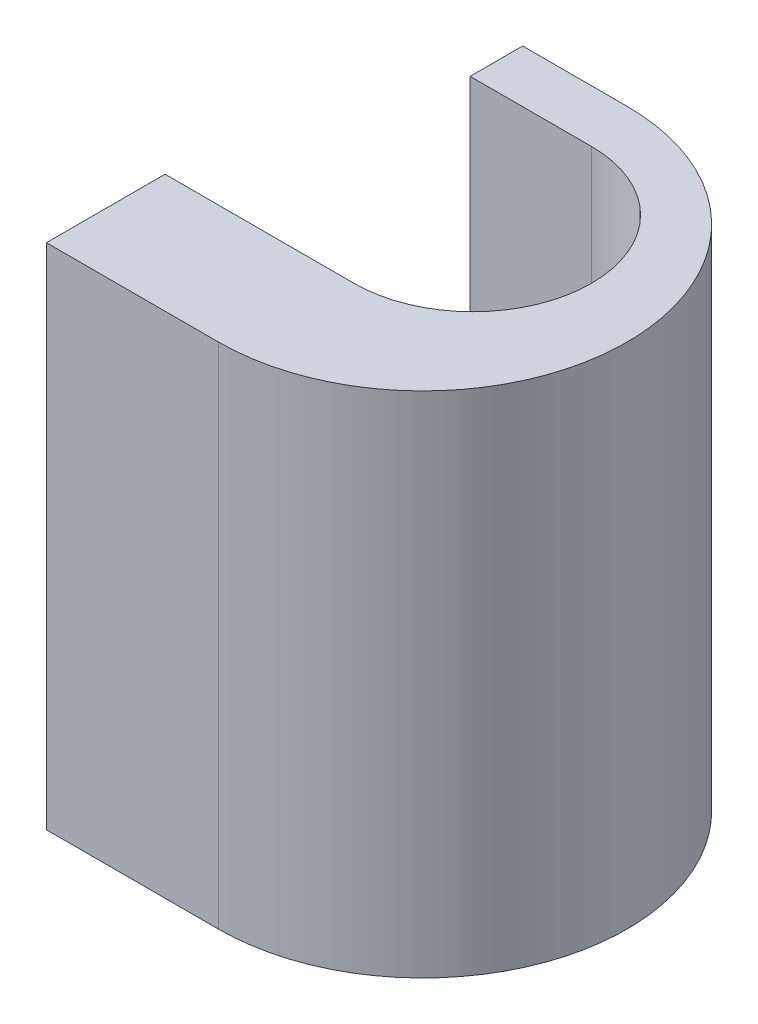
from build123d import *

# Parameters (mm, degrees)
SKETCH1_R           = 1.7
BOSS_EXTRUDE2_DEPTH = 4
BOSS_EXTRUDE3_DEPTH = 15


with BuildPart() as part:
    # Sketch1 → Boss-Extrude2 (new body)
    with BuildSketch(Plane(origin=(0, 0, 0), x_dir=(1, 0, 0), z_dir=(0, 1, 0))):
        with BuildLine():
            Line((-2.93579488, -0.53336368), (-2.93579488, 2.96663632))
            Line((-2.93579488, 2.96663632), (0.643666224, 2.96663632))
            ThreePointArc((0.643666224, 2.96663632), (4.143666224, -0.53336368), (0.643666224, -4.03336368))
            Line((0.643666224, -4.03336368), (-2.93579488, -4.03336368))
            Line((-2.93579488, -4.03336368), (-2.93579488, -0.53336368))
        make_face()
        with Locations(Location((0, 0, 0), (0, 0, 270))):
            Circle(SKETCH1_R, mode=Mode.SUBTRACT)
    extrude(amount=BOSS_EXTRUDE2_DEPTH)

    # Sketch2 → Boss-Extrude3 (add)
    with BuildSketch(Plane(origin=(0, 0, 0), x_dir=(1, 0, 0), z_dir=(0, 1, 0))):
        with BuildLine():
            Line((-2.93579488, 4.517571778), (0.143666226, 4.517571778))
            ThreePointArc((0.143666226, 4.517571778), (6.169133955, -1.507895951), (0.143666226, -7.53336368))
            Line((0.143666226, -7.53336368), (-3.435794878, -7.53336368))
            Line((-3.435794878, -7.53336368), (-4.93579488, -7.53336368))
            Line((-4.93579488, -7.53336368), (-4.93579488, -4.03336368))
            Line((-4.93579488, -4.03336368), (-2.93579488, -4.03336368))
            Line((-2.93579488, -4.03336368), (0.643666224, -4.03336368))
            ThreePointArc((0.643666224, -4.03336368), (4.143666224, -0.53336368), (0.643666224, 2.96663632))
            Line((0.643666224, 2.96663632), (-2.93579488, 2.96663632))
            Line((-2.93579488, 2.96663632), (-2.93579488, 4.517571778))
        make_face()
    extrude(amount=BOSS_EXTRUDE3_DEPTH)


solid = part.part
